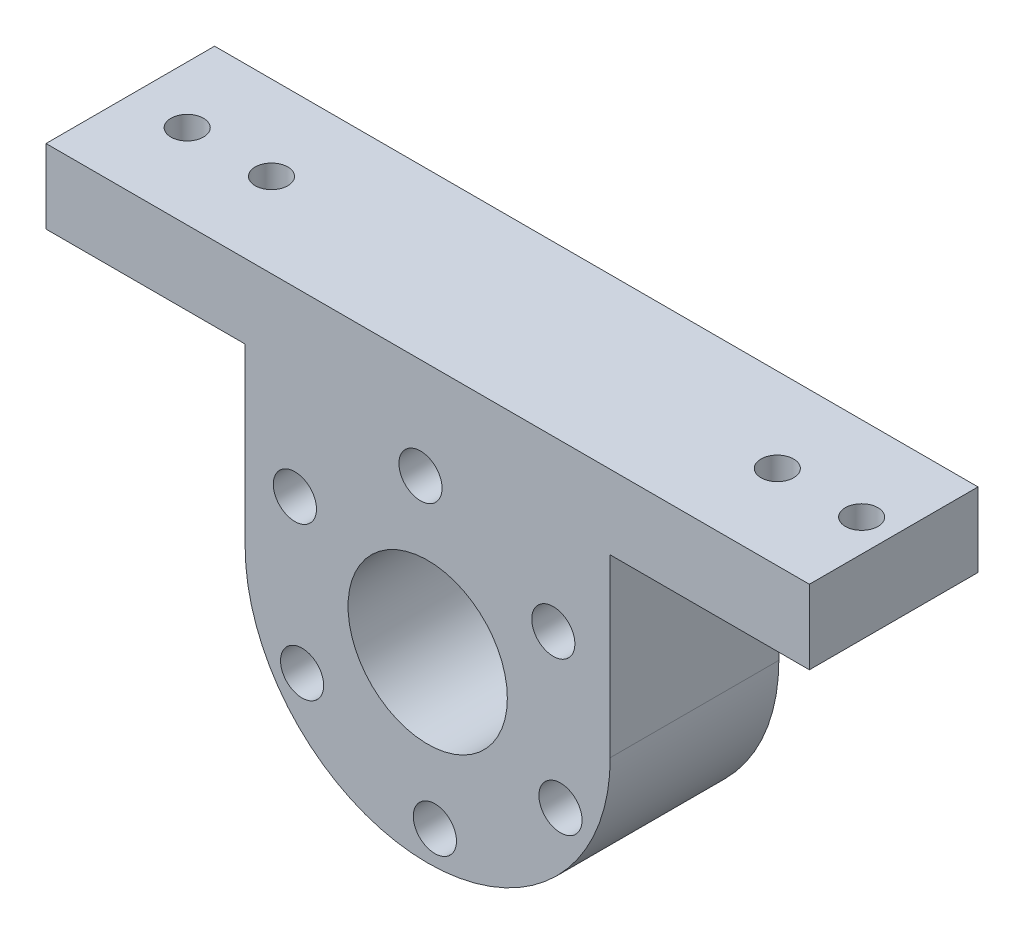
from build123d import *

# Parameters (mm, degrees)
SKETCH1_W           = 30
SKETCH1_H           = 11.167486893
SKETCH1_R           = 27.5
SKETCH1_R_2         = 3.25
SKETCH1_R_3         = 12
BOSS_EXTRUDE1_DEPTH = 25.4
SKETCH2_R           = 2.45745
CUT_EXTRUDE1_DEPTH  = 31


with BuildPart() as part:
    # Sketch1 → Boss-Extrude1 (new body)
    # profile 1 of 4: a face of its own
    with BuildSketch(Plane.XY):
        with Locations((-100, -5.583743447)):
            Rectangle(SKETCH1_W, SKETCH1_H)
    # profile 2 of 4: a face of its own
    with BuildSketch(Plane.XY):
        with BuildLine():
            Line((-85, -11.167486893), (-85, -37.625000004))
            ThreePointArc((-85, -37.625000004), (-57.5, -10.125000004), (-30, -37.625000004))
            Line((-30, -37.625000004), (-30, -11.167486893))
            Line((-30, -11.167486893), (-30, 0))
            Line((-30, 0), (-85, 0))
            Line((-85, 0), (-85, -11.167486893))
        make_face()
    # profile 3 of 4: a face of its own
    with BuildSketch(Plane.XY):
        with Locations((-57.5, -37.625000004)):
            Circle(SKETCH1_R)
        with Locations((-58.583096057, -15.151083947)):
            Circle(SKETCH1_R_2, mode=Mode.SUBTRACT)
        with Locations((-38.578565801, -25.450053276)):
            Circle(SKETCH1_R_2, mode=Mode.SUBTRACT)
        with Locations((-37.495469744, -47.923969333)):
            Circle(SKETCH1_R_2, mode=Mode.SUBTRACT)
        with Locations((-56.416903943, -60.098916061)):
            Circle(SKETCH1_R_2, mode=Mode.SUBTRACT)
        with Locations((-76.421434199, -49.799946732)):
            Circle(SKETCH1_R_2, mode=Mode.SUBTRACT)
        with Locations((-77.504530256, -27.326030675)):
            Circle(SKETCH1_R_2, mode=Mode.SUBTRACT)
        with Locations((-57.5, -37.625000004)):
            Circle(SKETCH1_R_3, mode=Mode.SUBTRACT)
    # profile 4 of 4: a face of its own
    with BuildSketch(Plane.XY):
        with Locations((-15, -5.583743447)):
            Rectangle(SKETCH1_W, SKETCH1_H)
    extrude(amount=BOSS_EXTRUDE1_DEPTH)

    # Sketch2 → Cut-Extrude1 (cut)
    with BuildSketch(Plane(origin=(0, 0, 0), x_dir=(1, 0, 0), z_dir=(0, 1, 0))):
        with Locations(Location((-93.73, -12.7, 0), (0, 0, 270))):
            Circle(SKETCH2_R)
        with Locations(Location((-106.43, -12.7, 0), (0, 0, 270))):
            Circle(SKETCH2_R)
        with Locations(Location((-17.53, -12.7, 0), (0, 0, 270))):
            Circle(SKETCH2_R)
        with Locations(Location((-4.83, -12.7, 0), (0, 0, 270))):
            Circle(SKETCH2_R)
    extrude(amount=-CUT_EXTRUDE1_DEPTH, mode=Mode.SUBTRACT)


solid = part.part
